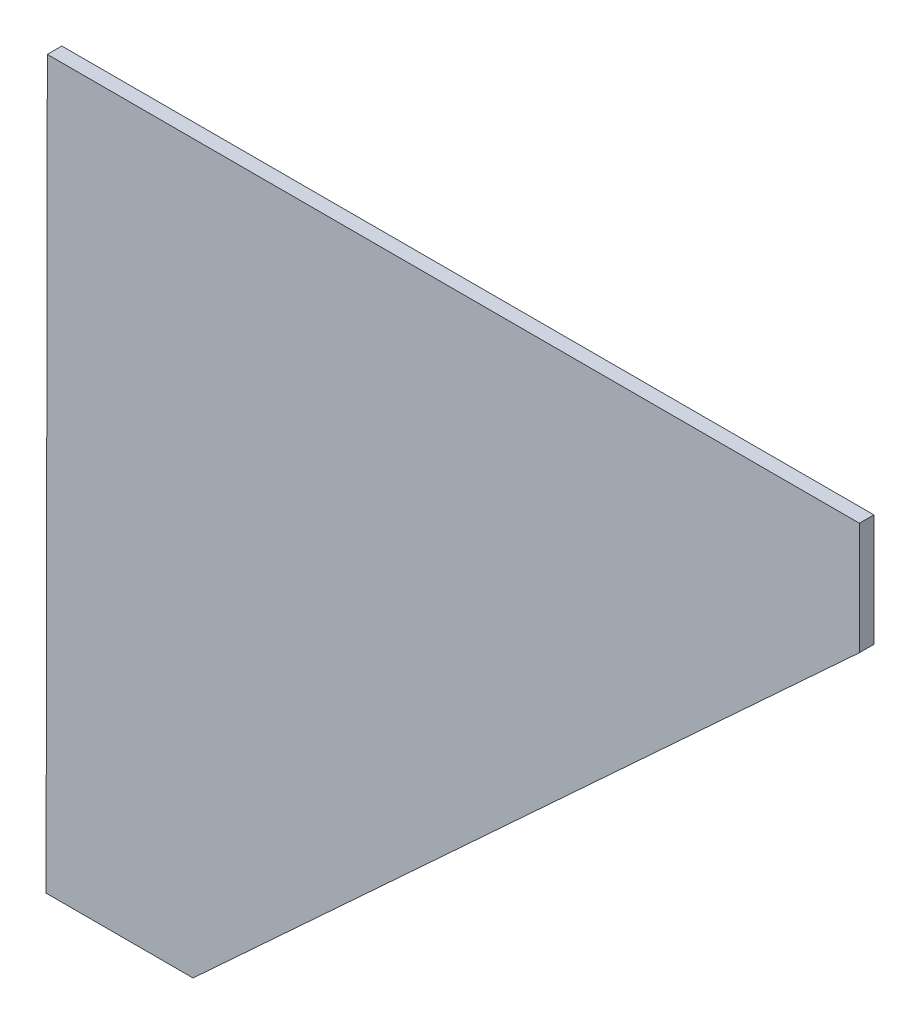
from build123d import *

# Parameters (mm, degrees)
BOSS_EXTRUDE1_DEPTH = 9.525


with BuildPart() as part:
    # Sketch1 → Boss-Extrude1 (new body)
    with BuildSketch(Plane.XY):
        Polygon((-1993.5728, -463.229720641), (-1555.877960592, -59.369720641), (-1555.877960592, 14.290279359), (-2089.277960592, 14.290279359), (-2090.0928, -463.229720641), align=None)
    extrude(amount=BOSS_EXTRUDE1_DEPTH)


solid = part.part
